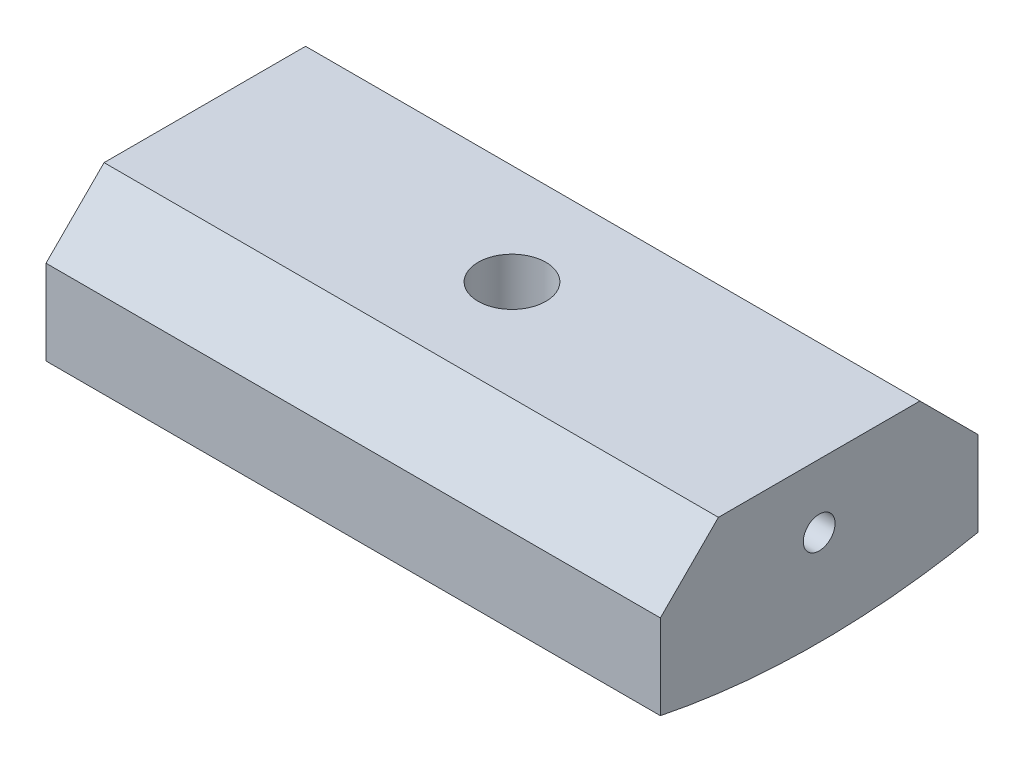
from build123d import *

# Parameters (mm, degrees)
BOSS_EXTRUDE1_DEPTH = 58.024
SKETCH2_R           = 3.2
CUT_EXTRUDE1_DEPTH  = 62.780130916
SKETCH4_R           = 1.5
CUT_EXTRUDE2_DEPTH  = 5
CUT_EXTRUDE4_START  = -5
SKETCH5_R           = 1.5
CUT_EXTRUDE4_DEPTH  = 5


with BuildPart() as part:
    # Sketch1 → Boss-Extrude1 (new body)
    with BuildSketch(Plane(origin=(0, 0, 0), x_dir=(0, 0, -1), z_dir=(1, 0, 0))):
        with BuildLine():
            Line((15, -73.484692283), (15, -65.484692283))
            Line((15, -65.484692283), (9.515307717, -60))
            Line((9.515307717, -60), (0, -60))
            Line((0, -60), (-9.515307717, -60))
            Line((-9.515307717, -60), (-15, -65.484692283))
            Line((-15, -65.484692283), (-15, -73.484692283))
            ThreePointArc((-15, -73.484692283), (0, -75), (15, -73.484692283))
        make_face()
    extrude(amount=BOSS_EXTRUDE1_DEPTH)

    # Sketch2 → Cut-Extrude1 (cut, through all)
    with BuildSketch(Plane(origin=(0, -60, 0), x_dir=(1, 0, 0), z_dir=(0, 1, 0))):
        with Locations(Location((29.012, 0, 0), (0, 0, 270))):
            Circle(SKETCH2_R)
    extrude(amount=-CUT_EXTRUDE1_DEPTH, mode=Mode.SUBTRACT)

    # Sketch4 → Cut-Extrude2 (cut)
    with BuildSketch(Plane(origin=(0, 0, 0), x_dir=(0, 0, -1), z_dir=(1, 0, 0))):
        with Locations((0, -66)):
            Circle(SKETCH4_R)
    extrude(amount=CUT_EXTRUDE2_DEPTH, mode=Mode.SUBTRACT)

    # Sketch5 → Cut-Extrude4 (cut)
    with BuildSketch(Plane(origin=(58.024, 0, 0), x_dir=(0, 0, -1), z_dir=(1, 0, 0)).offset(CUT_EXTRUDE4_START)):
        with Locations((0, -66)):
            Circle(SKETCH5_R)
    extrude(amount=CUT_EXTRUDE4_DEPTH, mode=Mode.SUBTRACT)


solid = part.part
